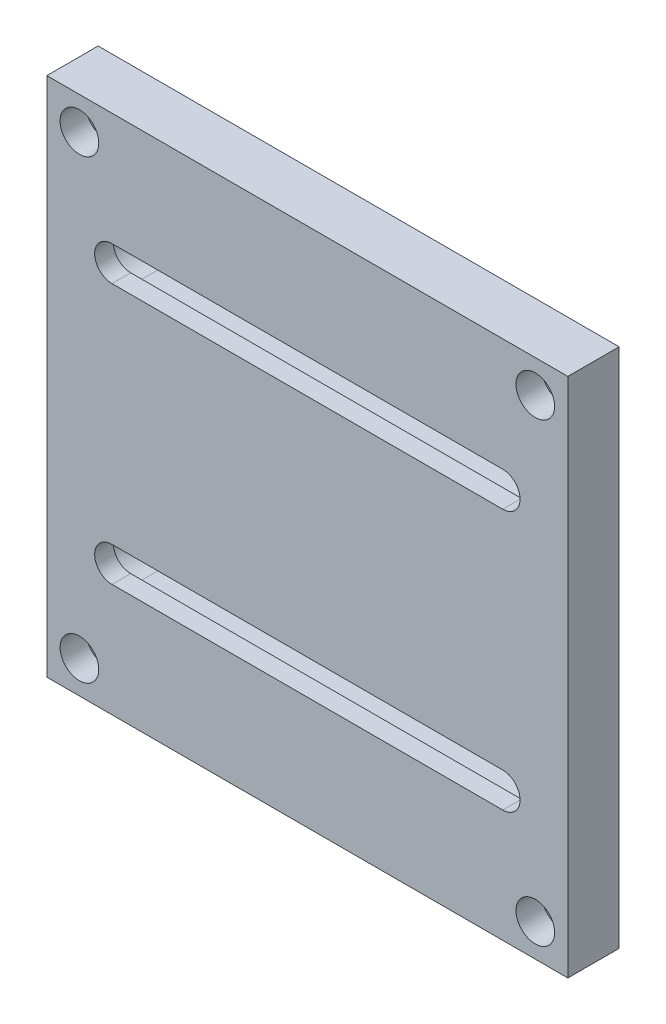
from build123d import *

# Parameters (mm, degrees)
SKETCH1_W                                        = 101.6
SKETCH1_H                                        = 101.6
BOSS_EXTRUDE1_DEPTH                              = 10
CBORE_FOR_6_BUTTON_HEAD_CAP_SCREW1_D             = 3.7973
CBORE_FOR_6_BUTTON_HEAD_CAP_SCREW1_CBORE_D       = 7.54126
CBORE_FOR_6_BUTTON_HEAD_CAP_SCREW1_CBORE_DEPTH   = 5.08
CBORE_FOR_1_4_SOCKET_HEAD_CAP_SCREW1_D           = 6.7564
CBORE_FOR_1_4_SOCKET_HEAD_CAP_SCREW1_CBORE_D     = 11.1125
CBORE_FOR_1_4_SOCKET_HEAD_CAP_SCREW1_CBORE_DEPTH = 6.35
SKETCH8_W                                        = 76.2
SKETCH8_H                                        = 11.1125
CUT_EXTRUDE1_DEPTH                               = 6.35
SKETCH10_W                                       = 76.2
SKETCH10_H                                       = 6.7564
CUT_EXTRUDE2_DEPTH                               = 135.853429693


with BuildPart() as part:
    # Sketch1 → Boss-Extrude1 (new body)
    with BuildSketch(Plane.XY):
        with Locations((-44.45, -44.45)):
            Rectangle(SKETCH1_W, SKETCH1_H)
    extrude(amount=BOSS_EXTRUDE1_DEPTH)

    # CBORE for #6 Button Head Cap Screw1 (through all)
    with Locations(Plane.XY.offset(10)):
        with Locations((0, 0), (0, -88.9), (-88.9, -88.9), (-88.9, 0)):
            CounterBoreHole(CBORE_FOR_6_BUTTON_HEAD_CAP_SCREW1_D / 2, CBORE_FOR_6_BUTTON_HEAD_CAP_SCREW1_CBORE_D / 2, CBORE_FOR_6_BUTTON_HEAD_CAP_SCREW1_CBORE_DEPTH)

    # CBORE for 1/4 Socket Head Cap Screw1 (through all)
    with Locations(Plane(origin=(0, 0, 0), x_dir=(-1, 0, 0), z_dir=(0, 0, -1))):
        with Locations((82.55, -19.05), (82.55, -69.85), (6.35, -69.85), (6.35, -19.05)):
            CounterBoreHole(CBORE_FOR_1_4_SOCKET_HEAD_CAP_SCREW1_D / 2, CBORE_FOR_1_4_SOCKET_HEAD_CAP_SCREW1_CBORE_D / 2, CBORE_FOR_1_4_SOCKET_HEAD_CAP_SCREW1_CBORE_DEPTH)

    # Sketch8 → Cut-Extrude1 (cut)
    with BuildSketch(Plane(origin=(0, 0, 0), x_dir=(-1, 0, 0), z_dir=(0, 0, -1))):
        with Locations((44.45, -19.05)):
            Rectangle(SKETCH8_W, SKETCH8_H)
        with Locations((44.45, -69.85)):
            Rectangle(SKETCH8_W, SKETCH8_H)
    extrude(amount=-CUT_EXTRUDE1_DEPTH, mode=Mode.SUBTRACT)

    # Sketch10 → Cut-Extrude2 (cut, through all)
    with BuildSketch(Plane(origin=(0, 0, 6.35), x_dir=(-1, 0, 0), z_dir=(0, 0, -1))):
        with Locations((44.45, -19.05)):
            Rectangle(SKETCH10_W, SKETCH10_H)
        with Locations((44.45, -69.85)):
            Rectangle(SKETCH10_W, SKETCH10_H)
    extrude(amount=-CUT_EXTRUDE2_DEPTH, mode=Mode.SUBTRACT)


solid = part.part
